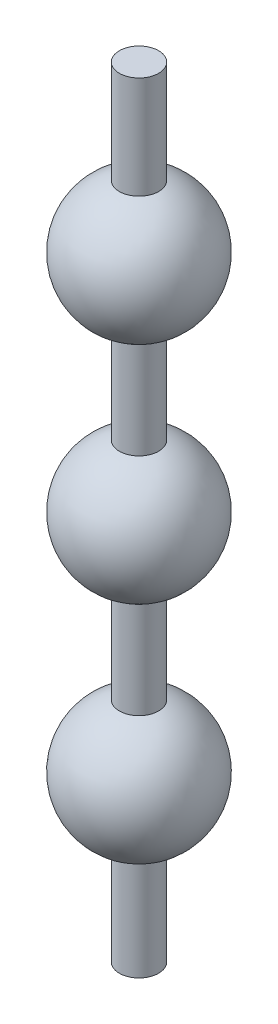
from build123d import *

# Parameters (mm, degrees)
SKETCH1_R           = 1.905
BOSS_EXTRUDE1_DEPTH = 10.16
SKETCH4_R           = 1.905
BOSS_EXTRUDE2_DEPTH = 10.16
SKETCH7_R           = 1.905
BOSS_EXTRUDE3_DEPTH = 10.16
SKETCH9_R           = 1.905
BOSS_EXTRUDE4_DEPTH = 10.16


with BuildPart() as part:
    # Sketch1 → Boss-Extrude1 (new body)
    with BuildSketch(Plane(origin=(0, 0, 0), x_dir=(1, 0, 0), z_dir=(0, 1, 0))):
        with Locations(Location((0, 0, 0), (0, 0, 270))):
            Circle(SKETCH1_R)
    extrude(amount=BOSS_EXTRUDE1_DEPTH)


with BuildPart() as body_2:
    # Sketch3 → Revolve1 (revolve)
    with BuildSketch(Plane.XY):
        with BuildLine():
            Line((0, 9.652), (0, 22.352))
            ThreePointArc((0, 22.352), (6.35, 16.002), (0, 9.652))
        make_face()
    revolve(axis=Axis((0, 9.652, 0), (0, 1, 0)))

    # Sketch4 → Boss-Extrude2 (add)
    with BuildSketch(Plane(origin=(0, 21.844, 0), x_dir=(-1, 0, 0), z_dir=(0, -1, 0))):
        with Locations(Location((0, 0, 0), (0, 0, 90))):
            Circle(SKETCH4_R)
    extrude(amount=-BOSS_EXTRUDE2_DEPTH)

    # Sketch6 → Revolve2 (revolve)
    with BuildSketch(Plane.XY):
        with BuildLine():
            Line((0, 31.496), (0, 44.196))
            ThreePointArc((0, 44.196), (6.35, 37.846), (0, 31.496))
        make_face()
    revolve(axis=Axis((0, 31.496, 0), (0, 1, 0)))

    # Sketch7 → Boss-Extrude3 (add)
    with BuildSketch(Plane(origin=(0, 43.688, 0), x_dir=(-1, 0, 0), z_dir=(0, -1, 0))):
        Circle(SKETCH7_R)
    extrude(amount=-BOSS_EXTRUDE3_DEPTH)

    # Sketch8 → Revolve3 (revolve)
    with BuildSketch(Plane(origin=(0, 0, 0), x_dir=(0, 0, -1), z_dir=(1, 0, 0))):
        with BuildLine():
            Line((0, 53.34), (0, 66.04))
            ThreePointArc((0, 66.04), (6.35, 59.69), (0, 53.34))
        make_face()
    revolve(axis=Axis((0, 53.34, 0), (0, 1, 0)))

    # Sketch9 → Boss-Extrude4 (add)
    with BuildSketch(Plane(origin=(0, 65.532, 0), x_dir=(-1, 0, 0), z_dir=(0, -1, 0))):
        Circle(SKETCH9_R)
    extrude(amount=-BOSS_EXTRUDE4_DEPTH)


solid = Compound([part.part, body_2.part])
